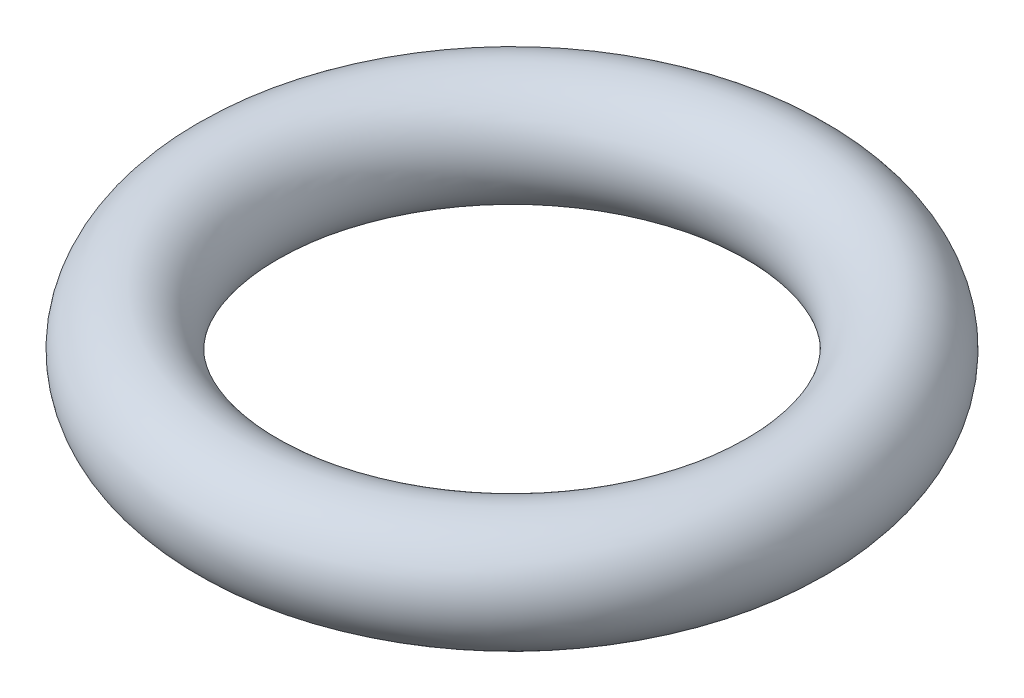
from build123d import *

# Parameters (mm, degrees)
SKETCH2_R = 0.8


with BuildPart() as part:
    # Sweep1: sweep along a path in Sketch1
    with BuildLine(Plane(origin=(0, 0, 0), x_dir=(1, 0, 0), z_dir=(0, 1, 0))) as sweep1_path:
        CenterArc((0, 0), 3.925, 0, 360)
    # Sketch2 → Sweep1 (sweep)
    with BuildSketch(Plane.XY):
        with Locations((3.925, 0)):
            Circle(SKETCH2_R)
    sweep(path=sweep1_path.line)


solid = part.part
